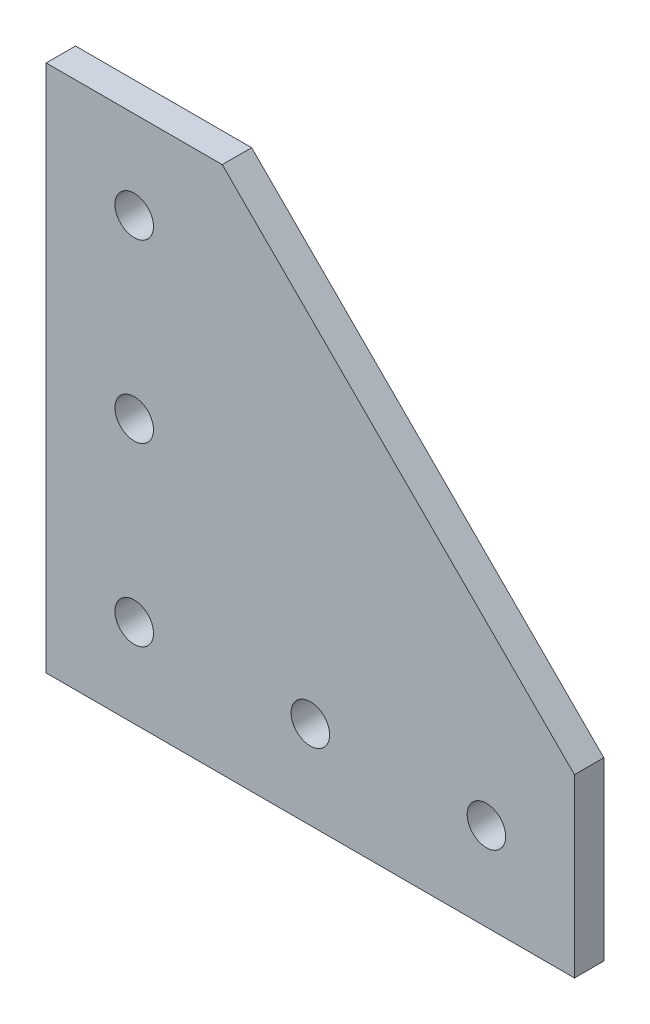
from build123d import *

# Parameters (mm, degrees)
BASE_EXTRUDE_DEPTH  = 6.35
SKETCH2_R           = 4.1656
HOLE1_DEPTH         = 162.769287876
HOLE1_PATTERN_COUNT = 3
HOLE1_PATTERN_PITCH = 38.1
SKETCH3_R           = 4.1656
HOLE2_DEPTH         = 162.769287876
HOLE2_PATTERN_COUNT = 2
HOLE2_PATTERN_PITCH = 38.1


with BuildPart() as part:
    # Sketch1 → Base Extrude (new body)
    with BuildSketch(Plane.XY):
        Polygon((0, 0), (0, 114.3), (38.1, 114.3), (114.3, 38.1), (114.3, 0), align=None)
    extrude(amount=BASE_EXTRUDE_DEPTH)

    # Sketch2 → Hole1 (cut, through all)
    with BuildSketch(Plane.XY.offset(6.35)):
        with Locations((19.05, 19.05)):
            Circle(SKETCH2_R)
    hole1 = extrude(amount=-HOLE1_DEPTH, mode=Mode.SUBTRACT)

    # Hole1 Pattern: Hole1 ×3
    with Locations(*[(i * HOLE1_PATTERN_PITCH, 0, 0) for i in range(1, HOLE1_PATTERN_COUNT)]):
        add(hole1, mode=Mode.SUBTRACT)

    # Sketch3 → Hole2 (cut, through all)
    with BuildSketch(Plane.XY.offset(6.35)):
        with Locations((19.05, 57.15)):
            Circle(SKETCH3_R)
    hole2 = extrude(amount=-HOLE2_DEPTH, mode=Mode.SUBTRACT)

    # Hole2 Pattern: Hole2 ×2
    with Locations(*[(0, i * HOLE2_PATTERN_PITCH, 0) for i in range(1, HOLE2_PATTERN_COUNT)]):
        add(hole2, mode=Mode.SUBTRACT)


solid = part.part
